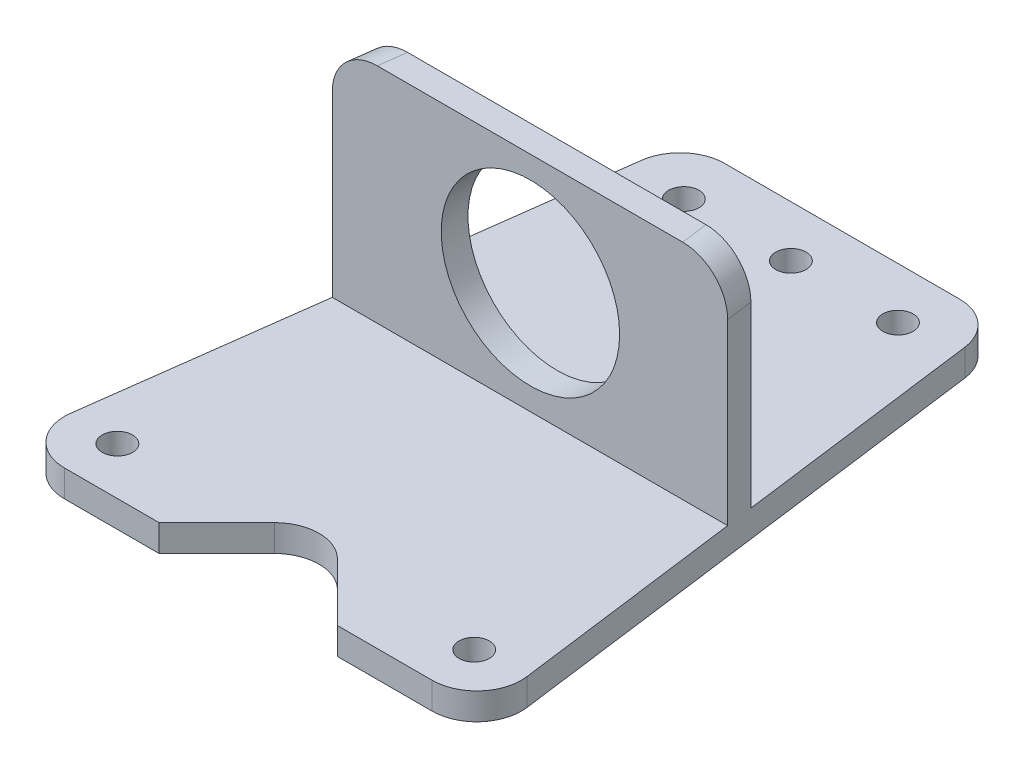
from build123d import *

# Parameters (mm, degrees)
SKETCH_1_R          = 1.7
EXTRUDE_2_DEPTH     = 3
EXTRUDE_3_DEPTH     = 25
SKETCH_4_R          = 10
CUT_EXTRUDE_1_DEPTH = 10
CUT_EXTRUDE_2_DEPTH = 10
FILLET_1_R          = 5


with BuildPart() as part:
    # 草图1 → 凸台-拉伸2 (new body)
    with BuildSketch(Plane(origin=(0, 0, 0), x_dir=(1, 0, 0), z_dir=(0, 1, 0))):
        Polygon((-17.55770441, -482.808341248), (17.55770441, -482.808341248), (26.316406952, -549.377139365), (-26.316406952, -549.377139365), align=None)
        with Locations(Location((-20, -544.050368455, 0), (0, 0, 270))):
            Circle(SKETCH_1_R, mode=Mode.SUBTRACT)
        with Locations(Location((20, -544.050368455, 0), (0, 0, 270))):
            Circle(SKETCH_1_R, mode=Mode.SUBTRACT)
        with Locations(Location((0, -488.550368455, 0), (0, 0, 270))):
            Circle(SKETCH_1_R, mode=Mode.SUBTRACT)
        with Locations(Location((-12, -488.550368455, 0), (0, 0, 270))):
            Circle(SKETCH_1_R, mode=Mode.SUBTRACT)
        with Locations(Location((12, -488.550368455, 0), (0, 0, 270))):
            Circle(SKETCH_1_R, mode=Mode.SUBTRACT)
    extrude(amount=EXTRUDE_2_DEPTH)

    # 草图3 → 凸台-拉伸3 (add)
    with BuildSketch(Plane(origin=(0, 3, 0), x_dir=(1, 0, 0), z_dir=(0, 1, 0))):
        Polygon((21.767013545, -514.800368455), (-21.767013545, -514.800368455), (-22.161734621, -517.800368455), (22.161734621, -517.800368455), align=None)
    extrude(amount=EXTRUDE_3_DEPTH)

    # 草图4 → 切除-拉伸1 (cut)
    with BuildSketch(Plane.XY.offset(517.800368455)):
        with Locations((0.051445108, 15.498034667)):
            Circle(SKETCH_4_R)
    extrude(amount=-CUT_EXTRUDE_1_DEPTH, mode=Mode.SUBTRACT)

    # 草图5 → 切除-拉伸2 (cut)
    with BuildSketch(Plane(origin=(0, 3, 0), x_dir=(1, 0, 0), z_dir=(0, 1, 0))):
        Polygon((0, -549.377139365), (10, -549.377139365), (0, -539.377139365), (-10, -549.377139365), align=None)
    extrude(amount=-CUT_EXTRUDE_2_DEPTH, mode=Mode.SUBTRACT)

    # 圆角1
    fillet_1_edges = [part.edges().sort_by_distance(p)[0] for p in [
        (-17.55770441, 1.5, 482.808341248),
        (17.55770441, 1.5, 482.808341248),
        (26.316406952, 1.5, 549.377139365),
        (-26.316406952, 1.5, 549.377139365),
        (-21.964374083, 28, 516.300368455),
        (21.964374083, 28, 516.300368455),
        (0, 1.5, 539.377139365),
    ]]
    fillet(fillet_1_edges, radius=FILLET_1_R)


solid = part.part
